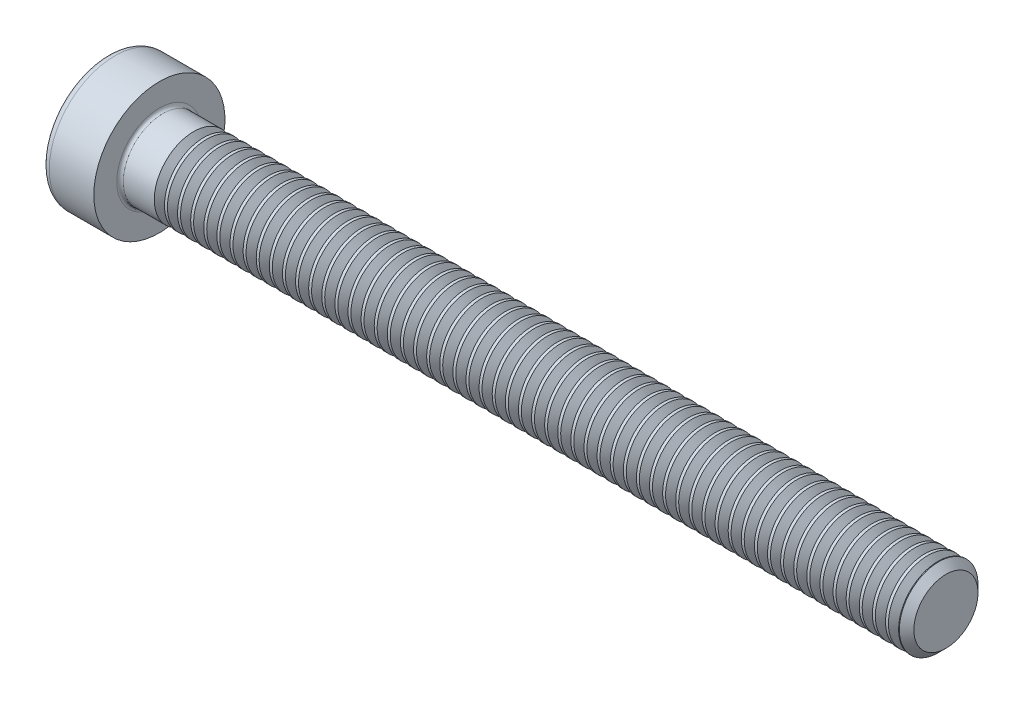
from build123d import *

# Parameters (mm, degrees)
FILLET1_R       = 0.25
FILLET2_R       = 0.6
HEX_2_DEPTH     = 2.5
THDSCHPAT_COUNT = 57
THDSCHPAT_PITCH = 1


with BuildPart() as part:
    # BodySke → Base-Revolve (revolve)
    with BuildSketch(Plane.XY, mode=Mode.PRIVATE) as base_revolve_sk:
        Polygon((0, 0), (0, 5), (4, 5), (4, 3), (63.4455, 3), (64, 2.4455), (64, 0), align=None)
    revolve(base_revolve_sk.sketch.rotate(Axis((-31.75, 0, 0), (1, 0, 0)), 90), axis=Axis((-31.75, 0, 0), (1, 0, 0)))

    # Fillet1
    fillet1_edges = [part.edges().sort_by_distance(p)[0] for p in [
        (4, 0, -3),
    ]]
    fillet(fillet1_edges, radius=FILLET1_R)

    # Fillet2
    fillet2_edges = [part.edges().sort_by_distance(p)[0] for p in [
        (0, 0, -5),
    ]]
    fillet(fillet2_edges, radius=FILLET2_R)

    # HexSke → Hex 2 (cut)
    with BuildSketch(Plane(origin=(0, 0, 0), x_dir=(0, 0.500000000000001, 0.866025403784438), z_dir=(-1, 0, 0))):
        Polygon((1.443375673, 2.5), (-1.443375673, 2.5), (-2.886751346, 0), (-1.443375673, -2.5), (1.443375673, -2.5), (2.886751346, 0), align=None)
    extrude(amount=-HEX_2_DEPTH, mode=Mode.SUBTRACT)

    # PilotSke → Hex-PreBroach (revolve, cut)
    with BuildSketch(Plane.XY, mode=Mode.PRIVATE) as hex_prebroach_sk:
        Polygon((0, 2.5), (2.5, 2.5), (3.077350269, 1.5), (5, 1.5), (5.866025404, 0), (0, 0), align=None)
    revolve(hex_prebroach_sk.sketch.rotate(Axis((0, 0, 0), (1, 0, 0)), 90), axis=Axis((0, 0, 0), (1, 0, 0)), mode=Mode.SUBTRACT)

    # ThdSchSke → ThreadSchematic (revolve, cut)
    with BuildSketch(Plane.XY):
        Polygon((7, -2.4455), (6.61173492, -3), (6.61173492, -3.75), (7.38826508, -3.75), (7.38826508, -3), align=None)
    threadschematic = revolve(axis=Axis((-3.175, 0, 0), (1, 0, 0)), mode=Mode.SUBTRACT)

    # ThdSchPat: ThreadSchematic ×57
    with Locations(*[(i * THDSCHPAT_PITCH, 0, 0) for i in range(1, THDSCHPAT_COUNT)]):
        add(threadschematic, mode=Mode.SUBTRACT)


solid = part.part
